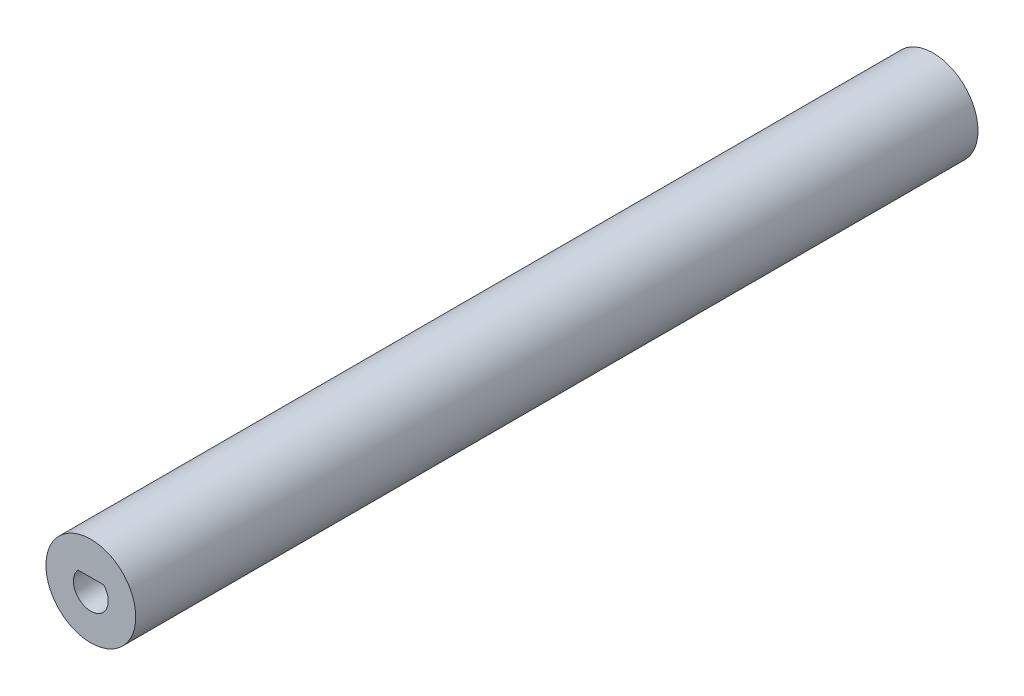
from build123d import *

# Parameters (mm, degrees)
IZIM1_R                     = 4
Y_KSEKLIK_EKSTR_ZYON1_DEPTH = 75
KES_EKSTR_ZYON1_DEPTH       = 104


with BuildPart() as part:
    # Çizim1 → Yükseklik-Ekstrüzyon1 (new body)
    with BuildSketch(Plane.XY):
        Circle(IZIM1_R)
    extrude(amount=Y_KSEKLIK_EKSTR_ZYON1_DEPTH)

    # Çizim2 → Kes-Ekstrüzyon1 (cut)
    with BuildSketch(Plane.XY.offset(75)):
        with BuildLine():
            Line((-1.140175425, 1.05), (1.140175425, 1.05))
            ThreePointArc((1.140175425, 1.05), (0, -1.55), (-1.140175425, 1.05))
        make_face()
    extrude(amount=-KES_EKSTR_ZYON1_DEPTH, mode=Mode.SUBTRACT)


solid = part.part
